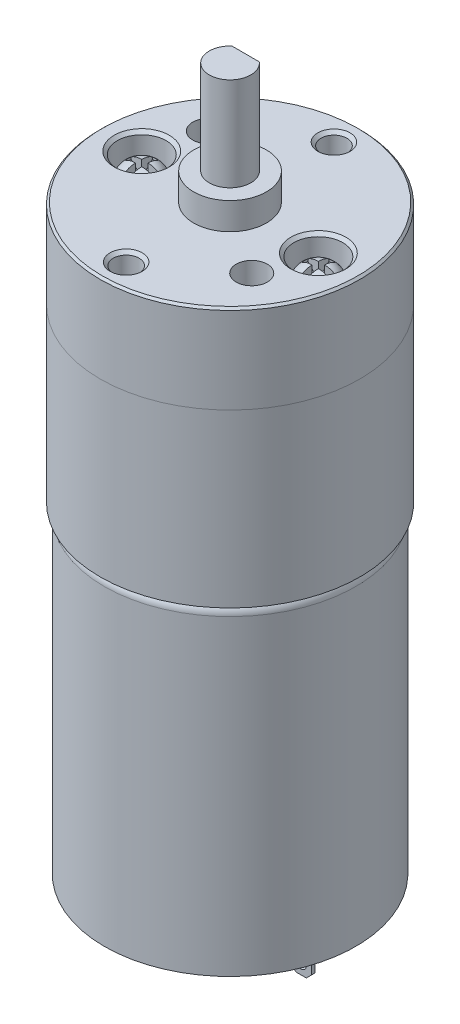
from build123d import *
from build123d.topology import SkipClean

# Parameters (mm, degrees)
SKETCH1_R               = 12.1
BOSS_EXTRUDE1_DEPTH     = 31
FILLET1_R               = 1
SKETCH2_R               = 12.5
BOSS_EXTRUDE2_DEPTH     = 25
CHAMFER1_SIZE           = 0.2
SKETCH4_R               = 11.7
CUT_EXTRUDE1_DEPTH      = 0.9
SKETCH5_R               = 3.25
BOSS_EXTRUDE3_DEPTH     = 2.2
FILLET2_R               = 1
SKETCH7_W               = 2
SKETCH7_H               = 0.35
BOSS_EXTRUDE4_DEPTH     = 4
CHAMFER2_SIZE           = 0.5
CUT_EXTRUDE2_DEPTH      = 60.028378367
CUT_EXTRUDE2_DEPTH_BACK = 4
SKETCH8_R               = 0.5
SKETCH9_R               = 4.75
SKETCH9_R_2             = 3.75
CUT_EXTRUDE3_DEPTH      = 0.2
CUT_EXTRUDE4_DEPTH      = 10
SKETCH11_R              = 3.5
BOSS_EXTRUDE5_DEPTH     = 2.6
SKETCH12_R              = 2
BOSS_EXTRUDE6_DEPTH     = 9
SKETCH13_W              = 4.672818147
SKETCH13_H              = 0.992736672
CUT_EXTRUDE5_DEPTH      = 8
SKETCH14_R              = 2.35
CUT_EXTRUDE6_DEPTH      = 3
SKETCH15_R              = 1.95442331
BOSS_EXTRUDE7_DEPTH     = 2
FILLET3_R               = 1.5
CUT_EXTRUDE7_DEPTH      = 1.5
CHAMFER3_SIZE           = 1
CHAMFER4_SIZE           = 0.3
SKETCH17_R              = 1.25
CUT_EXTRUDE8_DEPTH      = 6
CHAMFER5_SIZE           = 0.3
SKETCH18_R              = 1.5
CUT_EXTRUDE9_DEPTH      = 5


with BuildPart() as part:
    # Sketch1 → Boss-Extrude1 (new body)
    with BuildSketch(Plane(origin=(0, 0, 0), x_dir=(1, 0, 0), z_dir=(0, 1, 0))):
        with Locations(Location((0, 0, 0), (0, 0, 270))):
            Circle(SKETCH1_R)
    extrude(amount=BOSS_EXTRUDE1_DEPTH)

    # Fillet1
    fillet1_edges = [part.edges().sort_by_distance(p)[0] for p in [
        (0, 31, -12.1),
    ]]
    fillet(fillet1_edges, radius=FILLET1_R)

    # Sketch4 → Cut-Extrude1 (cut)
    with BuildSketch(Plane.XZ):
        with Locations(Location((0, 0, 0), (0, 0, 270))):
            Circle(SKETCH4_R)
    extrude(amount=-CUT_EXTRUDE1_DEPTH, mode=Mode.SUBTRACT)

    # Sketch5 → Boss-Extrude3 (add)
    with BuildSketch(Plane.XZ.offset(-0.9)):
        with Locations(Location((0, 0, 0), (0, 0, 270))):
            Circle(SKETCH5_R)
    extrude(amount=BOSS_EXTRUDE3_DEPTH)

    # Fillet2
    fillet2_edges = [part.edges().sort_by_distance(p)[0] for p in [
        (0, -1.3, 3.25),
    ]]
    fillet(fillet2_edges, radius=FILLET2_R)

    # Sketch7 → Boss-Extrude4 (add)
    with BuildSketch(Plane.XZ.offset(-0.9)):
        with Locations((-8.661017218, -1.534994682)):
            Rectangle(SKETCH7_W, SKETCH7_H)
        with Locations((8.749524169, 1.732340014)):
            Rectangle(SKETCH7_W, SKETCH7_H)
    extrude(amount=BOSS_EXTRUDE4_DEPTH)

    # Chamfer2
    chamfer2_edges = [part.edges().sort_by_distance(p)[0] for p in [
        (-9.661017218, -3.1, -1.534994682),
        (-7.661017218, -3.1, -1.534994682),
        (7.749524169, -3.1, 1.732340014),
        (9.749524169, -3.1, 1.732340014),
    ]]
    chamfer(chamfer2_edges, length=CHAMFER2_SIZE)

    # Sketch8 → Cut-Extrude2 (cut, two sides: drawn at the far end of the back side and taken through both)
    with BuildSketch(Plane.XY.offset(-1.359994682).offset(-CUT_EXTRUDE2_DEPTH_BACK)):
        with Locations(Location((-8.661017218, -2.1, 0), (0, 0, 180))):
            Circle(SKETCH8_R)
        with Locations(Location((8.749524169, -2.1, 0), (0, 0, 180))):
            Circle(SKETCH8_R)
    extrude(amount=CUT_EXTRUDE2_DEPTH + CUT_EXTRUDE2_DEPTH_BACK, mode=Mode.SUBTRACT)

    # Sketch9 → Cut-Extrude3 (cut)
    with BuildSketch(Plane.XZ.offset(-0.9)):
        with Locations(Location((0, 0, 0), (0, 0, 270))):
            Circle(SKETCH9_R)
        with Locations(Location((0, 0, 0), (0, 0, 270))):
            Circle(SKETCH9_R_2, mode=Mode.SUBTRACT)
    extrude(amount=-CUT_EXTRUDE3_DEPTH, mode=Mode.SUBTRACT)

    # Sketch10 → Cut-Extrude4 (cut)
    with SkipClean():  # the faces are left unmerged after this step: merging them gives an invalid solid
        with BuildSketch(Plane.XZ.offset(-1.1)):
            with BuildLine():
                ThreePointArc((-3.417338247, 1.544117647), (-3.75, 0), (-3.417338247, -1.544117647))
                ThreePointArc((-3.417338247, -1.544117647), (-3.667100993, -2.2056451), (-4.328628446, -1.955882353))
                ThreePointArc((-4.328628446, -1.955882353), (-4.75, 0), (-4.328628446, 1.955882353))
                ThreePointArc((-4.328628446, 1.955882353), (-3.667100993, 2.2056451), (-3.417338247, 1.544117647))
            make_face()
            with BuildLine():
                ThreePointArc((4.328628446, -1.955882353), (3.667100993, -2.2056451), (3.417338247, -1.544117647))
                ThreePointArc((3.417338247, -1.544117647), (3.75, 0), (3.417338247, 1.544117647))
                ThreePointArc((3.417338247, 1.544117647), (3.667100993, 2.2056451), (4.328628446, 1.955882353))
                ThreePointArc((4.328628446, 1.955882353), (4.75, 0), (4.328628446, -1.955882353))
            make_face()
        extrude(amount=-CUT_EXTRUDE4_DEPTH, mode=Mode.SUBTRACT)


with BuildPart() as body_2:
    # Sketch2 → Boss-Extrude2 (new body)
    with BuildSketch(Plane(origin=(0, 31, 0), x_dir=(1, 0, 0), z_dir=(0, 1, 0))):
        with Locations(Location((0, 0, 0), (0, 0, 270))):
            Circle(SKETCH2_R)
    extrude(amount=BOSS_EXTRUDE2_DEPTH)

    # Chamfer1
    chamfer1_edges = [body_2.edges().sort_by_distance(p)[0] for p in [
        (0, 56, -12.5),
    ]]
    chamfer(chamfer1_edges, length=CHAMFER1_SIZE)

    # Sketch14 → Cut-Extrude6 (cut)
    with BuildSketch(Plane(origin=(0, 56, 0), x_dir=(1, 0, 0), z_dir=(0, 1, 0))):
        with Locations(Location((-8.5, 0, 0), (0, 0, 270))):
            Circle(SKETCH14_R)
        with Locations(Location((8.5, 0, 0), (0, 0, 270))):
            Circle(SKETCH14_R)
    extrude(amount=-CUT_EXTRUDE6_DEPTH, mode=Mode.SUBTRACT)

    # Chamfer4
    chamfer4_edges = [body_2.edges().sort_by_distance(p)[0] for p in [
        (-8.5, 56, -2.35),
        (8.5, 56, -2.35),
    ]]
    chamfer(chamfer4_edges, length=CHAMFER4_SIZE)

    # Sketch17 → Cut-Extrude8 (cut)
    with BuildSketch(Plane(origin=(0, 56, 0), x_dir=(1, 0, 0), z_dir=(0, 1, 0))):
        with Locations(Location((0, 10, 0), (0, 0, 270))):
            Circle(SKETCH17_R)
        with Locations(Location((0, -10, 0), (0, 0, 270))):
            Circle(SKETCH17_R)
    extrude(amount=-CUT_EXTRUDE8_DEPTH, mode=Mode.SUBTRACT)

    # Chamfer5
    chamfer5_edges = [body_2.edges().sort_by_distance(p)[0] for p in [
        (0, 56, -11.25),
        (0, 56, 8.75),
    ]]
    chamfer(chamfer5_edges, length=CHAMFER5_SIZE)

    # Sketch18 → Cut-Extrude9 (cut)
    with BuildSketch(Plane(origin=(0, 56, 0), x_dir=(1, 0, 0), z_dir=(0, 1, 0))):
        with Locations(Location((-6.962792376, 4.875399709, 0), (0, 0, 270))):
            Circle(SKETCH18_R)
        with Locations(Location((6.962792376, -4.875399709, 0), (0, 0, 270))):
            Circle(SKETCH18_R)
    extrude(amount=-CUT_EXTRUDE9_DEPTH, mode=Mode.SUBTRACT)


with BuildPart() as body_3:
    # Sketch11 → Boss-Extrude5 (new body)
    with BuildSketch(Plane(origin=(0, 56, 0), x_dir=(1, 0, 0), z_dir=(0, 1, 0))):
        with Locations(Location((0, 0, 0), (0, 0, 270))):
            Circle(SKETCH11_R)
    extrude(amount=BOSS_EXTRUDE5_DEPTH)


with BuildPart() as body_4:
    # Sketch12 → Boss-Extrude6 (new body)
    with BuildSketch(Plane(origin=(0, 58.6, 0), x_dir=(1, 0, 0), z_dir=(0, 1, 0))):
        with Locations(Location((0, 0, 0), (0, 0, 270))):
            Circle(SKETCH12_R)
    extrude(amount=BOSS_EXTRUDE6_DEPTH)

    # Sketch13 → Cut-Extrude5 (cut)
    with BuildSketch(Plane(origin=(0, 67.6, 0), x_dir=(1, 0, 0), z_dir=(0, 1, 0))):
        with Locations((-0.120471852, 1.996368336)):
            Rectangle(SKETCH13_W, SKETCH13_H)
    extrude(amount=-CUT_EXTRUDE5_DEPTH, mode=Mode.SUBTRACT)


with BuildPart() as body_5:
    # Sketch15 → Boss-Extrude7 (new body)
    with BuildSketch(Plane(origin=(0, 53, 0), x_dir=(1, 0, 0), z_dir=(0, 1, 0))):
        with Locations(Location((-8.5, 0, 0), (0, 0, 270))):
            Circle(SKETCH15_R)
    extrude(amount=BOSS_EXTRUDE7_DEPTH)

    # Fillet3
    fillet3_edges = [body_5.edges().sort_by_distance(p)[0] for p in [
        (-8.5, 55, -1.95442331),
    ]]
    fillet(fillet3_edges, radius=FILLET3_R)

    # Sketch16 → Cut-Extrude7 (cut)
    with BuildSketch(Plane(origin=(0, 55, 0), x_dir=(1, 0, 0), z_dir=(0, 1, 0))):
        Polygon((-8.2, -1.317498097), (-8.8, -1.317498097), (-8.8, -0.3), (-9.817498097, -0.3), (-9.817498097, 0.3), (-8.8, 0.3), (-8.8, 1.317498097), (-8.2, 1.317498097), (-8.2, 0.3), (-7.182501903, 0.3), (-7.182501903, -0.3), (-8.2, -0.3), align=None)
    extrude(amount=-CUT_EXTRUDE7_DEPTH, mode=Mode.SUBTRACT)

    # Chamfer3
    chamfer3_edges = [body_5.edges().sort_by_distance(p)[0] for p in [
        (-8.5, 53.5, -1.317498097),
        (-7.182501903, 53.5, 0),
        (-8.5, 53.5, 1.317498097),
        (-9.817498097, 53.5, 0),
    ]]
    chamfer(chamfer3_edges, length=CHAMFER3_SIZE)


with BuildPart() as body_6:
    # Mirror1: mirrored copy
    add(body_5.part.mirror(Plane(origin=(0, 0, 0), x_dir=(0, 0, 1), z_dir=(1, 0, 0))))


solid = Compound([part.part, body_2.part, body_3.part, body_4.part, body_5.part, body_6.part])
